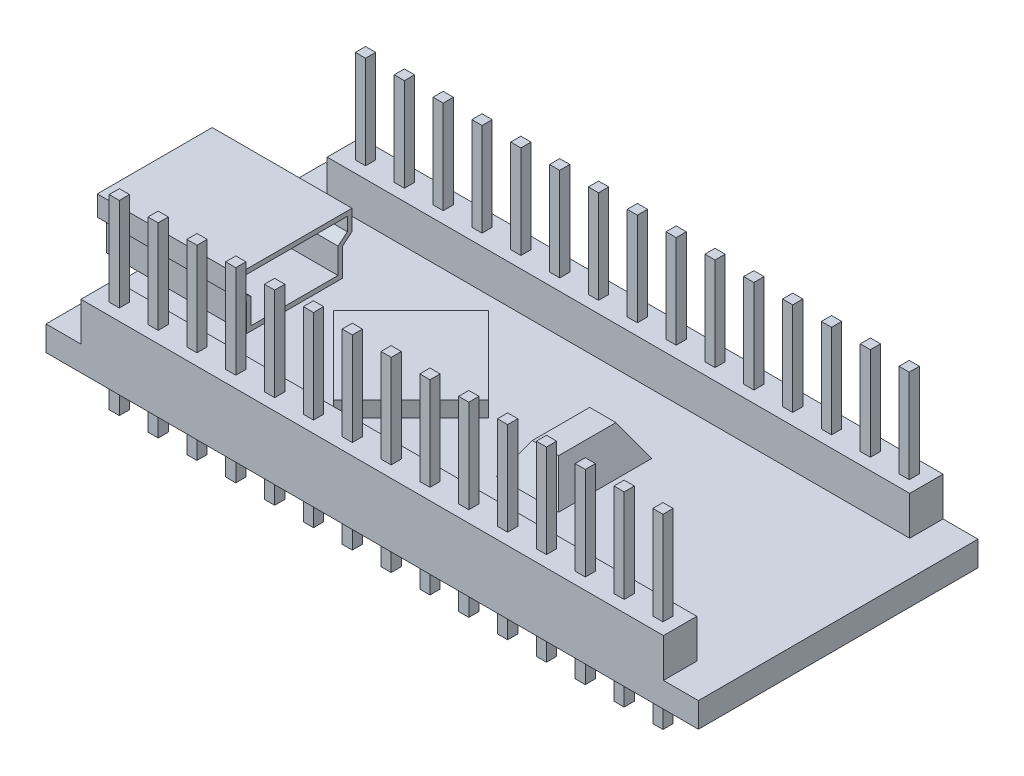
from build123d import *

# Parameters (mm, degrees)
SKETCH1_W                = 42
SKETCH1_H                = 18
BOSS_EXTRUDE1_DEPTH      = 1.6
EXTRUDE_THIN1_START      = -7
EXTRUDE_THIN1_DEPTH      = 9
SKETCH3_W                = 18.75
SKETCH3_H                = 2.148280867
BOSS_EXTRUDE2_DEPTH      = 2.5
SKETCH4_W                = 0.654719532
SKETCH4_H                = 0.654719531
BOSS_EXTRUDE3_DEPTH      = 6
LPATTERN1_COUNT          = 15
LPATTERN1_PITCH          = 2.5
MIRROR4_COPY_1_SKETCH_W  = 0.654719532
MIRROR4_COPY_1_SKETCH_H  = 0.654719531
MIRROR4_COPY_1_DEPTH     = 6
MIRROR4_COPY_2_SKETCH_W  = 0.654719532
MIRROR4_COPY_2_SKETCH_H  = 0.654719531
MIRROR4_COPY_2_DEPTH     = 6
MIRROR4_COPY_3_SKETCH_W  = 0.654719532
MIRROR4_COPY_3_SKETCH_H  = 0.654719531
MIRROR4_COPY_3_DEPTH     = 6
MIRROR4_COPY_4_SKETCH_W  = 0.654719532
MIRROR4_COPY_4_SKETCH_H  = 0.654719531
MIRROR4_COPY_4_DEPTH     = 6
MIRROR4_COPY_5_SKETCH_W  = 0.654719532
MIRROR4_COPY_5_SKETCH_H  = 0.654719531
MIRROR4_COPY_5_DEPTH     = 6
MIRROR4_COPY_6_SKETCH_W  = 0.654719532
MIRROR4_COPY_6_SKETCH_H  = 0.654719531
MIRROR4_COPY_6_DEPTH     = 6
MIRROR4_COPY_7_SKETCH_W  = 0.654719532
MIRROR4_COPY_7_SKETCH_H  = 0.654719531
MIRROR4_COPY_7_DEPTH     = 6
MIRROR4_COPY_8_SKETCH_W  = 0.654719532
MIRROR4_COPY_8_SKETCH_H  = 0.654719531
MIRROR4_COPY_8_DEPTH     = 6
MIRROR4_COPY_9_SKETCH_W  = 0.654719532
MIRROR4_COPY_9_SKETCH_H  = 0.654719531
MIRROR4_COPY_9_DEPTH     = 6
MIRROR4_COPY_10_SKETCH_W = 0.654719532
MIRROR4_COPY_10_SKETCH_H = 0.654719531
MIRROR4_COPY_10_DEPTH    = 6
MIRROR4_COPY_11_SKETCH_W = 0.654719532
MIRROR4_COPY_11_SKETCH_H = 0.654719531
MIRROR4_COPY_11_DEPTH    = 6
MIRROR4_COPY_12_SKETCH_W = 0.654719532
MIRROR4_COPY_12_SKETCH_H = 0.654719531
MIRROR4_COPY_12_DEPTH    = 6
MIRROR4_COPY_13_SKETCH_W = 0.654719532
MIRROR4_COPY_13_SKETCH_H = 0.654719531
MIRROR4_COPY_13_DEPTH    = 6
MIRROR4_COPY_14_SKETCH_W = 0.654719532
MIRROR4_COPY_14_SKETCH_H = 0.654719531
MIRROR4_COPY_14_DEPTH    = 6
SKETCH_2_W               = 4
SKETCH_2_H               = 6
EXTRUDE_2_DEPTH          = 2
EXTRUDE_2_TAPER          = 30
EXTRUDE_3_DEPTH          = 1


with BuildPart() as part:
    # Sketch1 → Boss-Extrude1 (new body)
    with BuildSketch(Plane(origin=(0, 0, 0), x_dir=(1, 0, 0), z_dir=(0, 1, 0))):
        with Locations((21, 9)):
            Rectangle(SKETCH1_W, SKETCH1_H)
    extrude(amount=BOSS_EXTRUDE1_DEPTH)

    # Sketch2 → Extrude-Thin1 (add)
    with BuildSketch(Plane.ZY.offset(EXTRUDE_THIN1_START)):
        Polygon((-9, 1.6), (-12.1, 1.6), (-12.1, 3.4), (-12.7, 3.9), (-12.7, 5.2), (-9, 5.2), (-9, 4.9), (-12.4, 4.9), (-12.4, 4.040512484), (-11.8, 3.540512484), (-11.8, 1.9), (-9, 1.9), align=None)
    extrude_thin1 = extrude(amount=EXTRUDE_THIN1_DEPTH)

    # Mirror1: Extrude-Thin1 across plane
    add(extrude_thin1.mirror(Plane.XY.offset(-9)))

    # Sketch3 → Boss-Extrude2 (add)
    with BuildSketch(Plane.XZ.offset(-1.6)):
        with Locations((11.625, -1.074140433)):
            Rectangle(SKETCH3_W, SKETCH3_H)
        with Locations((30.375, -1.074140433)):
            Rectangle(SKETCH3_W, SKETCH3_H)
    boss_extrude2 = extrude(amount=-BOSS_EXTRUDE2_DEPTH)

    # Sketch4 → Boss-Extrude3 (add, symmetric)
    with BuildSketch(Plane.XZ.offset(-4.1)):
        with Locations((3.64534799, -1.074140433)):
            Rectangle(SKETCH4_W, SKETCH4_H)
    boss_extrude3 = extrude(amount=BOSS_EXTRUDE3_DEPTH, both=True)

    # LPattern1: Boss-Extrude3 ×15
    with Locations(*[(i * LPATTERN1_PITCH, 0, 0) for i in range(1, LPATTERN1_COUNT)]):
        add(boss_extrude3)

    # Mirror3: Boss-Extrude2 across plane
    add(boss_extrude2.mirror(Plane.XY.offset(-9)))

    # Mirror4: Boss-Extrude3 across plane
    add(boss_extrude3.mirror(Plane.XY.offset(-9)))

    # Mirror4 copy 1 sketch → Mirror4 copy 1 (add, symmetric)
    with BuildSketch(Plane(origin=(2.5, 4.1, -18), x_dir=(1, 0, 0), z_dir=(0, -1, 0))):
        with Locations((3.64534799, 1.074140433)):
            Rectangle(MIRROR4_COPY_1_SKETCH_W, MIRROR4_COPY_1_SKETCH_H)
    extrude(amount=MIRROR4_COPY_1_DEPTH, both=True)

    # Mirror4 copy 2 sketch → Mirror4 copy 2 (add, symmetric)
    with BuildSketch(Plane(origin=(5, 4.1, -18), x_dir=(1, 0, 0), z_dir=(0, -1, 0))):
        with Locations((3.64534799, 1.074140433)):
            Rectangle(MIRROR4_COPY_2_SKETCH_W, MIRROR4_COPY_2_SKETCH_H)
    extrude(amount=MIRROR4_COPY_2_DEPTH, both=True)

    # Mirror4 copy 3 sketch → Mirror4 copy 3 (add, symmetric)
    with BuildSketch(Plane(origin=(7.5, 4.1, -18), x_dir=(1, 0, 0), z_dir=(0, -1, 0))):
        with Locations((3.64534799, 1.074140433)):
            Rectangle(MIRROR4_COPY_3_SKETCH_W, MIRROR4_COPY_3_SKETCH_H)
    extrude(amount=MIRROR4_COPY_3_DEPTH, both=True)

    # Mirror4 copy 4 sketch → Mirror4 copy 4 (add, symmetric)
    with BuildSketch(Plane(origin=(10, 4.1, -18), x_dir=(1, 0, 0), z_dir=(0, -1, 0))):
        with Locations((3.64534799, 1.074140433)):
            Rectangle(MIRROR4_COPY_4_SKETCH_W, MIRROR4_COPY_4_SKETCH_H)
    extrude(amount=MIRROR4_COPY_4_DEPTH, both=True)

    # Mirror4 copy 5 sketch → Mirror4 copy 5 (add, symmetric)
    with BuildSketch(Plane(origin=(12.5, 4.1, -18), x_dir=(1, 0, 0), z_dir=(0, -1, 0))):
        with Locations((3.64534799, 1.074140433)):
            Rectangle(MIRROR4_COPY_5_SKETCH_W, MIRROR4_COPY_5_SKETCH_H)
    extrude(amount=MIRROR4_COPY_5_DEPTH, both=True)

    # Mirror4 copy 6 sketch → Mirror4 copy 6 (add, symmetric)
    with BuildSketch(Plane(origin=(15, 4.1, -18), x_dir=(1, 0, 0), z_dir=(0, -1, 0))):
        with Locations((3.64534799, 1.074140433)):
            Rectangle(MIRROR4_COPY_6_SKETCH_W, MIRROR4_COPY_6_SKETCH_H)
    extrude(amount=MIRROR4_COPY_6_DEPTH, both=True)

    # Mirror4 copy 7 sketch → Mirror4 copy 7 (add, symmetric)
    with BuildSketch(Plane(origin=(17.5, 4.1, -18), x_dir=(1, 0, 0), z_dir=(0, -1, 0))):
        with Locations((3.64534799, 1.074140433)):
            Rectangle(MIRROR4_COPY_7_SKETCH_W, MIRROR4_COPY_7_SKETCH_H)
    extrude(amount=MIRROR4_COPY_7_DEPTH, both=True)

    # Mirror4 copy 8 sketch → Mirror4 copy 8 (add, symmetric)
    with BuildSketch(Plane(origin=(20, 4.1, -18), x_dir=(1, 0, 0), z_dir=(0, -1, 0))):
        with Locations((3.64534799, 1.074140433)):
            Rectangle(MIRROR4_COPY_8_SKETCH_W, MIRROR4_COPY_8_SKETCH_H)
    extrude(amount=MIRROR4_COPY_8_DEPTH, both=True)

    # Mirror4 copy 9 sketch → Mirror4 copy 9 (add, symmetric)
    with BuildSketch(Plane(origin=(22.5, 4.1, -18), x_dir=(1, 0, 0), z_dir=(0, -1, 0))):
        with Locations((3.64534799, 1.074140433)):
            Rectangle(MIRROR4_COPY_9_SKETCH_W, MIRROR4_COPY_9_SKETCH_H)
    extrude(amount=MIRROR4_COPY_9_DEPTH, both=True)

    # Mirror4 copy 10 sketch → Mirror4 copy 10 (add, symmetric)
    with BuildSketch(Plane(origin=(25, 4.1, -18), x_dir=(1, 0, 0), z_dir=(0, -1, 0))):
        with Locations((3.64534799, 1.074140433)):
            Rectangle(MIRROR4_COPY_10_SKETCH_W, MIRROR4_COPY_10_SKETCH_H)
    extrude(amount=MIRROR4_COPY_10_DEPTH, both=True)

    # Mirror4 copy 11 sketch → Mirror4 copy 11 (add, symmetric)
    with BuildSketch(Plane(origin=(27.5, 4.1, -18), x_dir=(1, 0, 0), z_dir=(0, -1, 0))):
        with Locations((3.64534799, 1.074140433)):
            Rectangle(MIRROR4_COPY_11_SKETCH_W, MIRROR4_COPY_11_SKETCH_H)
    extrude(amount=MIRROR4_COPY_11_DEPTH, both=True)

    # Mirror4 copy 12 sketch → Mirror4 copy 12 (add, symmetric)
    with BuildSketch(Plane(origin=(30, 4.1, -18), x_dir=(1, 0, 0), z_dir=(0, -1, 0))):
        with Locations((3.64534799, 1.074140433)):
            Rectangle(MIRROR4_COPY_12_SKETCH_W, MIRROR4_COPY_12_SKETCH_H)
    extrude(amount=MIRROR4_COPY_12_DEPTH, both=True)

    # Mirror4 copy 13 sketch → Mirror4 copy 13 (add, symmetric)
    with BuildSketch(Plane(origin=(32.5, 4.1, -18), x_dir=(1, 0, 0), z_dir=(0, -1, 0))):
        with Locations((3.64534799, 1.074140433)):
            Rectangle(MIRROR4_COPY_13_SKETCH_W, MIRROR4_COPY_13_SKETCH_H)
    extrude(amount=MIRROR4_COPY_13_DEPTH, both=True)

    # Mirror4 copy 14 sketch → Mirror4 copy 14 (add, symmetric)
    with BuildSketch(Plane(origin=(35, 4.1, -18), x_dir=(1, 0, 0), z_dir=(0, -1, 0))):
        with Locations((3.64534799, 1.074140433)):
            Rectangle(MIRROR4_COPY_14_SKETCH_W, MIRROR4_COPY_14_SKETCH_H)
    extrude(amount=MIRROR4_COPY_14_DEPTH, both=True)

    # Эскиз2 → Бобышка-Вытянуть2 (add)
    with BuildSketch(Plane(origin=(0, 1.6, 0), x_dir=(1, 0, 0), z_dir=(0, 1, 0))):
        with Locations((25, 9)):
            Rectangle(SKETCH_2_W, SKETCH_2_H)
    extrude(amount=EXTRUDE_2_DEPTH, taper=EXTRUDE_2_TAPER)

    # Эскиз3 → Бобышка-Вытянуть3 (add)
    with BuildSketch(Plane(origin=(0, 1.6, 0), x_dir=(1, 0, 0), z_dir=(0, 1, 0))):
        Polygon((14.5, 4), (19.5, 9), (14.5, 14), (9.5, 9), align=None)
    extrude(amount=EXTRUDE_3_DEPTH)


solid = part.part
